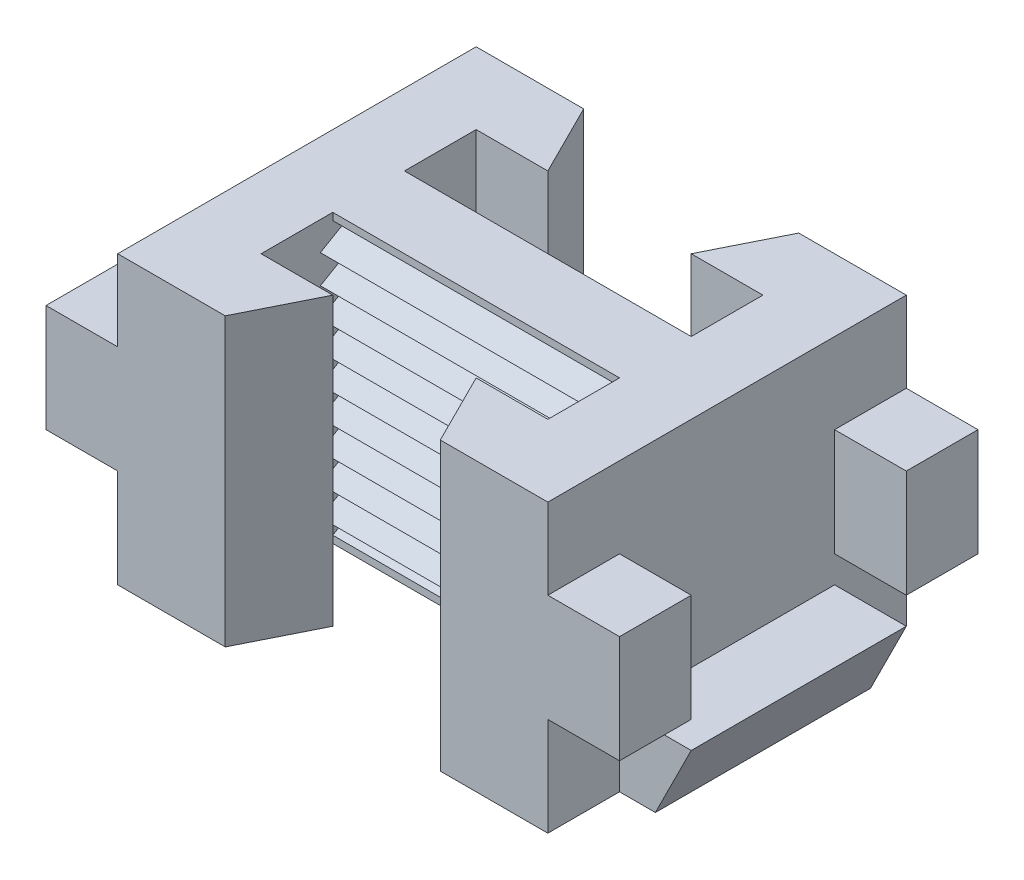
from build123d import *

# Parameters (mm, degrees)
BOSS_EXTRUDE1_DEPTH      = 1.25
BOSS_EXTRUDE1_DEPTH_BACK = 1.25
CUT_EXTRUDE1_DEPTH       = 10.842509843
CUT_EXTRUDE1_DEPTH_BACK  = 10.842509843
BOSS_EXTRUDE4_DEPTH      = 5
BOSS_EXTRUDE4_DEPTH_BACK = 5
BOSS_EXTRUDE2_DEPTH      = 3.75
BOSS_EXTRUDE2_DEPTH_BACK = 6.25
BOSS_EXTRUDE3_DEPTH      = 3.75
BOSS_EXTRUDE3_DEPTH_BACK = 3.75
BOSS_EXTRUDE5_DEPTH      = 0.9375
BOSS_EXTRUDE5_DEPTH_BACK = 2.8125
SKETCH6_W                = 2.5
SKETCH6_H                = 2.5


with BuildPart() as part:
    # Sketch1 → Boss-Extrude1 (new, two sides: drawn at the far end of the back side and taken through both)
    with BuildSketch(Plane.XY.offset(-BOSS_EXTRUDE1_DEPTH_BACK)):
        Polygon((-7.5, -3.75), (-7.5, -6.25), (7.5, -6.25), (7.5, -3.75), (7.5, 3.75), (-7.5, 3.75), align=None)
    extrude(amount=BOSS_EXTRUDE1_DEPTH + BOSS_EXTRUDE1_DEPTH_BACK)

    # Sketch4 → Cut-Extrude1 (cut, two sides: drawn at the far end of the back side and taken through both)
    with BuildSketch(Plane(origin=(0, 0, 0), x_dir=(0, 0, -1), z_dir=(1, 0, 0)).offset(-CUT_EXTRUDE1_DEPTH_BACK)):
        Polygon((-0.816987298, 3.25), (-1.466506351, 3.625), (-1.466506351, 2.875), align=None)
        Polygon((-1.466506351, 1.875), (-0.816987298, 2.25), (-1.466506351, 2.625), align=None)
        Polygon((-1.466506351, 0.875), (-0.816987298, 1.25), (-1.466506351, 1.625), align=None)
        Polygon((-1.466506351, -0.125), (-0.816987298, 0.25), (-1.466506351, 0.625), align=None)
        Polygon((-1.466506351, -1.125), (-0.816987298, -0.75), (-1.466506351, -0.375), align=None)
        Polygon((-1.466506351, -2.125), (-0.816987298, -1.75), (-1.466506351, -1.375), align=None)
        Polygon((-1.466506351, -3.125), (-0.816987298, -2.75), (-1.466506351, -2.375), align=None)
        Polygon((-1.466506351, -4.125), (-0.816987298, -3.75), (-1.466506351, -3.375), align=None)
        Polygon((-1.466506351, -5.125), (-0.816987298, -4.75), (-1.466506351, -4.375), align=None)
        Polygon((-1.466506351, -6.125), (-0.816987298, -5.75), (-1.466506351, -5.375), align=None)
        Polygon((1.466506351, -5.375), (1.466506351, -6.125), (0.816987298, -5.75), align=None)
        Polygon((1.466506351, -4.375), (1.466506351, -5.125), (0.816987298, -4.75), align=None)
        Polygon((1.466506351, -3.375), (1.466506351, -4.125), (0.816987298, -3.75), align=None)
        Polygon((1.466506351, -2.375), (1.466506351, -3.125), (0.816987298, -2.75), align=None)
        Polygon((1.466506351, -1.375), (1.466506351, -2.125), (0.816987298, -1.75), align=None)
        Polygon((1.466506351, -0.375), (1.466506351, -1.125), (0.816987298, -0.75), align=None)
        Polygon((1.466506351, 0.625), (1.466506351, -0.125), (0.816987298, 0.25), align=None)
        Polygon((1.466506351, 1.625), (1.466506351, 0.875), (0.816987298, 1.25), align=None)
        Polygon((1.466506351, 2.625), (1.466506351, 1.875), (0.816987298, 2.25), align=None)
        Polygon((1.466506351, 2.875), (0.816987298, 3.25), (1.466506351, 3.625), align=None)
    extrude(amount=CUT_EXTRUDE1_DEPTH + CUT_EXTRUDE1_DEPTH_BACK, mode=Mode.SUBTRACT)

    # Sketch5 → Boss-Extrude4 (add, two sides: drawn at the far end of the back side and taken through both)
    with BuildSketch(Plane(origin=(0, 0, 0), x_dir=(0, 0, -1), z_dir=(1, 0, 0)).offset(-BOSS_EXTRUDE4_DEPTH_BACK)):
        Polygon((1.683012702, 2.75), (1.033493649, 3.125), (1.033493649, 2.375), align=None)
        Polygon((1.033493649, 1.375), (1.683012702, 1.75), (1.033493649, 2.125), align=None)
        Polygon((1.033493649, 0.375), (1.683012702, 0.75), (1.033493649, 1.125), align=None)
        Polygon((1.033493649, -0.625), (1.683012702, -0.25), (1.033493649, 0.125), align=None)
        Polygon((1.033493649, -1.625), (1.683012702, -1.25), (1.033493649, -0.875), align=None)
        Polygon((1.033493649, -2.625), (1.683012702, -2.25), (1.033493649, -1.875), align=None)
        Polygon((1.033493649, -3.625), (1.683012702, -3.25), (1.033493649, -2.875), align=None)
        Polygon((1.033493649, -4.625), (1.683012702, -4.25), (1.033493649, -3.875), align=None)
        Polygon((1.033493649, -5.625), (1.683012702, -5.25), (1.033493649, -4.875), align=None)
        Polygon((-1.033493649, -4.875), (-1.033493649, -5.625), (-1.683012702, -5.25), align=None)
        Polygon((-1.033493649, -3.875), (-1.033493649, -4.625), (-1.683012702, -4.25), align=None)
        Polygon((-1.033493649, -2.875), (-1.033493649, -3.625), (-1.683012702, -3.25), align=None)
        Polygon((-1.033493649, -1.875), (-1.033493649, -2.625), (-1.683012702, -2.25), align=None)
        Polygon((-1.033493649, -0.875), (-1.033493649, -1.625), (-1.683012702, -1.25), align=None)
        Polygon((-1.033493649, 0.125), (-1.033493649, -0.625), (-1.683012702, -0.25), align=None)
        Polygon((-1.033493649, 1.125), (-1.033493649, 0.375), (-1.683012702, 0.75), align=None)
        Polygon((-1.033493649, 2.125), (-1.033493649, 1.375), (-1.683012702, 1.75), align=None)
        Polygon((-1.033493649, 2.375), (-1.683012702, 2.75), (-1.033493649, 3.125), align=None)
    extrude(amount=BOSS_EXTRUDE4_DEPTH + BOSS_EXTRUDE4_DEPTH_BACK)

    # Sketch2 → Boss-Extrude2 (add, two sides: drawn at the far end of the back side and taken through both)
    with BuildSketch(Plane(origin=(0, 0, 0), x_dir=(1, 0, 0), z_dir=(0, 1, 0)).offset(-BOSS_EXTRUDE2_DEPTH_BACK)):
        Polygon((-7.5, -6.25), (-3.75, -6.25), (-2.5, -3.75), (-5, -3.75), (-5, 3.75), (-2.5, 3.75), (-3.75, 6.25), (-7.5, 6.25), align=None)
        Polygon((7.5, -6.25), (3.75, -6.25), (2.5, -3.75), (5, -3.75), (5, 3.75), (2.5, 3.75), (3.75, 6.25), (7.5, 6.25), align=None)
    extrude(amount=BOSS_EXTRUDE2_DEPTH + BOSS_EXTRUDE2_DEPTH_BACK)

    # Sketch3 → Boss-Extrude3 (add, two sides: drawn at the far end of the back side and taken through both)
    with BuildSketch(Plane.XY.offset(-BOSS_EXTRUDE3_DEPTH_BACK)):
        Polygon((-6.25, -6.25), (-8.75, -6.25), (-10, -3.75), (-6.25, -3.75), align=None)
        Polygon((6.25, -6.25), (8.75, -6.25), (10, -3.75), (6.25, -3.75), align=None)
    extrude(amount=BOSS_EXTRUDE3_DEPTH + BOSS_EXTRUDE3_DEPTH_BACK)

    # Sketch6 → Boss-Extrude5 (add, two sides: drawn at the far end of the back side and taken through both)
    with BuildSketch(Plane(origin=(0, 0, 0), x_dir=(1, 0, 0), z_dir=(0, 1, 0)).offset(-BOSS_EXTRUDE5_DEPTH_BACK)):
        with Locations((-8.75, -5)):
            Rectangle(SKETCH6_W, SKETCH6_H)
        with Locations((-8.75, 5)):
            Rectangle(SKETCH6_W, SKETCH6_H)
        with Locations((8.75, 5)):
            Rectangle(SKETCH6_W, SKETCH6_H)
        with Locations((8.75, -5)):
            Rectangle(SKETCH6_W, SKETCH6_H)
    extrude(amount=BOSS_EXTRUDE5_DEPTH + BOSS_EXTRUDE5_DEPTH_BACK)


solid = part.part
